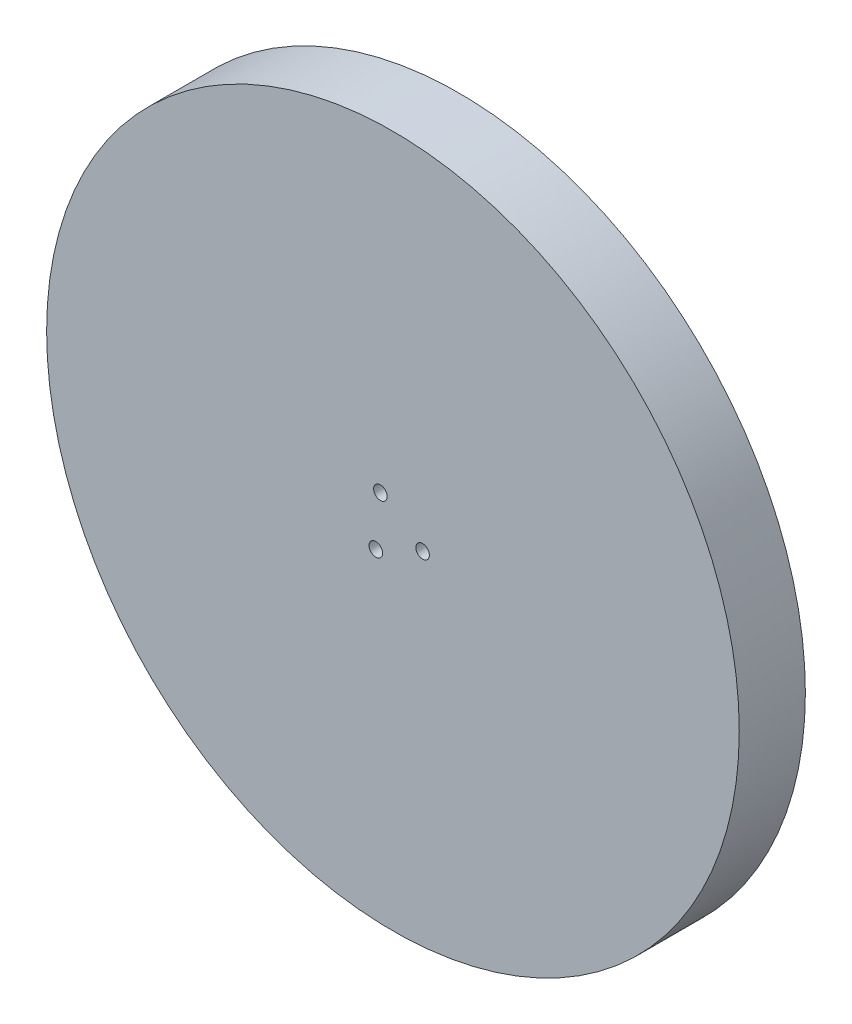
from build123d import *

# Parameters (mm, degrees)
SKETCH1_R                    = 52.37152557
BOSS_EXTRUDE1_DEPTH          = 10
F_2_05_2_05_DIAMETER_HOLE1_D = 2.05


with BuildPart() as part:
    # Sketch1 → Boss-Extrude1 (new body)
    with BuildSketch(Plane.XY):
        Circle(SKETCH1_R)
    extrude(amount=BOSS_EXTRUDE1_DEPTH)

    # Ø2.05 (2.05) Diameter Hole1 (through all)
    with Locations(Plane(origin=(-27.965211852, -165.986714684, 75.15314796), x_dir=(1, 0, 0), z_dir=(0, 0, 1))):
        with Locations((32.447172363, 165.584185204), (25.375630841, 162.306487764), (26.072832352, 170.069471085)):
            Hole(F_2_05_2_05_DIAMETER_HOLE1_D / 2)


solid = part.part
